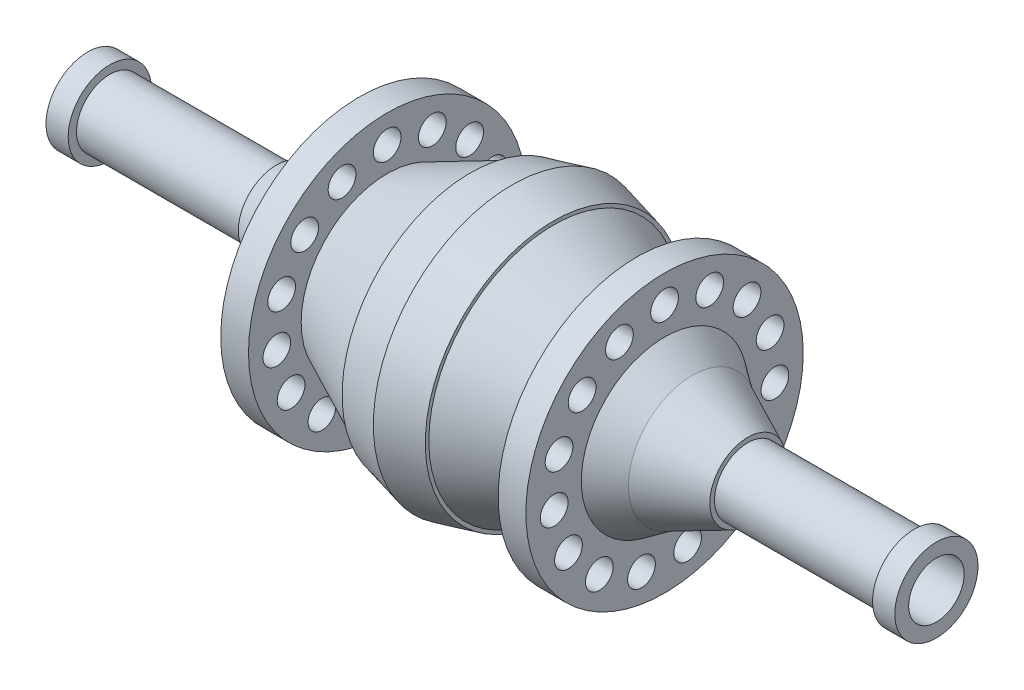
from build123d import *

# Parameters (mm, degrees)
SKETCH1_R                     = 25
BOSS_EXTRUDE1_DEPTH           = 7.5
BOSS_EXTRUDE1_TAPER           = 14
BOSS_EXTRUDE1_OTHER_WAY_DEPTH = 7.5
BOSS_EXTRUDE1_OTHER_WAY_TAPER = 14
SKETCH2_R                     = 22.5
BOSS_EXTRUDE2_DEPTH           = 15
BOSS_EXTRUDE2_TAPER           = 25
SKETCH3_R                     = 22.5
BOSS_EXTRUDE3_DEPTH           = 15
BOSS_EXTRUDE3_TAPER           = 25
SKETCH4_R                     = 25
BOSS_EXTRUDE4_DEPTH           = 5
BOSS_EXTRUDE5_START           = 5
SKETCH5_R                     = 25
BOSS_EXTRUDE5_DEPTH           = 5
SKETCH6_R                     = 2.5
CUT_EXTRUDE1_DEPTH            = 5
CUT_EXTRUDE2_START            = -50
SKETCH6_2_R                   = 2.5
CUT_EXTRUDE2_DEPTH            = 5
SKETCH7_R                     = 15
BOSS_EXTRUDE6_DEPTH           = 5
BOSS_EXTRUDE6_TAPER           = 35
SKETCH8_R                     = 11.498962309
BOSS_EXTRUDE7_DEPTH           = 10
BOSS_EXTRUDE7_TAPER           = 25
SKETCH10_R                    = 6
BOSS_EXTRUDE8_DEPTH           = 30
SKETCH11_R                    = 7.5
BOSS_EXTRUDE10_DEPTH          = 4
SKETCH14_R                    = 15
BOSS_EXTRUDE11_DEPTH          = 5
BOSS_EXTRUDE11_TAPER          = 35
SKETCH16_R                    = 11.509262746
BOSS_EXTRUDE12_DEPTH          = 10
BOSS_EXTRUDE12_TAPER          = 25
BOSS_EXTRUDE13_START          = 30
SKETCH17_R                    = 6
BOSS_EXTRUDE13_DEPTH          = 30
BOSS_EXTRUDE14_START          = 4
SKETCH18_R                    = 7.5
BOSS_EXTRUDE14_DEPTH          = 4
CUT_EXTRUDE3_START            = -153
SKETCH20_R                    = 5
CUT_EXTRUDE3_DEPTH            = 153


with BuildPart() as part:
    # Sketch1 → Boss-Extrude1 (new body)
    with BuildSketch(Plane(origin=(0, 0, 0), x_dir=(0, 0, -1), z_dir=(1, 0, 0))):
        Circle(SKETCH1_R)
    extrude(amount=BOSS_EXTRUDE1_DEPTH, taper=BOSS_EXTRUDE1_TAPER)

    # Sketch1 → Boss-Extrude1 other way (add)
    with BuildSketch(Plane(origin=(0, 0, 0), x_dir=(0, 0, -1), z_dir=(1, 0, 0))):
        Circle(SKETCH1_R)
    extrude(amount=-BOSS_EXTRUDE1_OTHER_WAY_DEPTH, taper=BOSS_EXTRUDE1_OTHER_WAY_TAPER)

    # Sketch2 → Boss-Extrude2 (add)
    with BuildSketch(Plane.ZY.offset(7.5)):
        Circle(SKETCH2_R)
    extrude(amount=BOSS_EXTRUDE2_DEPTH, taper=BOSS_EXTRUDE2_TAPER)

    # Sketch3 → Boss-Extrude3 (add)
    with BuildSketch(Plane(origin=(7.5, 0, 0), x_dir=(0, 0, -1), z_dir=(1, 0, 0))):
        Circle(SKETCH3_R)
    extrude(amount=BOSS_EXTRUDE3_DEPTH, taper=BOSS_EXTRUDE3_TAPER)

    # Sketch4 → Boss-Extrude4 (add)
    with BuildSketch(Plane(origin=(22.5, 0, 0), x_dir=(0, 0, -1), z_dir=(1, 0, 0))):
        Circle(SKETCH4_R)
    extrude(amount=BOSS_EXTRUDE4_DEPTH)

    # Sketch5 → Boss-Extrude5 (add)
    with BuildSketch(Plane.ZY.offset(22.5).offset(BOSS_EXTRUDE5_START)):
        with Locations(Location((0, 0, 0), (0, 0, 180))):
            Circle(SKETCH5_R)
    extrude(amount=-BOSS_EXTRUDE5_DEPTH)

    # Sketch6 → Cut-Extrude1 (cut)
    with BuildSketch(Plane.ZY.offset(27.5)):
        with Locations((0, 20)):
            Circle(SKETCH6_R)
        with Locations((8.134732862, 18.270909153)):
            Circle(SKETCH6_R)
        with Locations((14.86289651, 13.382612127)):
            Circle(SKETCH6_R)
        with Locations((19.021130326, 6.180339888)):
            Circle(SKETCH6_R)
        with Locations((19.890437907, -2.090569265)):
            Circle(SKETCH6_R)
        with Locations((17.320508076, -10)):
            Circle(SKETCH6_R)
        with Locations((11.755705046, -16.180339887)):
            Circle(SKETCH6_R)
        with Locations((4.158233816, -19.562952015)):
            Circle(SKETCH6_R)
        with Locations((-4.158233816, -19.562952015)):
            Circle(SKETCH6_R)
        with Locations((-11.755705046, -16.180339888)):
            Circle(SKETCH6_R)
        with Locations((-17.320508076, -10)):
            Circle(SKETCH6_R)
        with Locations((-19.890437907, -2.090569265)):
            Circle(SKETCH6_R)
        with Locations((-19.021130326, 6.180339887)):
            Circle(SKETCH6_R)
        with Locations((-14.86289651, 13.382612127)):
            Circle(SKETCH6_R)
        with Locations((-8.134732862, 18.270909153)):
            Circle(SKETCH6_R)
    extrude(amount=-CUT_EXTRUDE1_DEPTH, mode=Mode.SUBTRACT)

    # Sketch6<2> → Cut-Extrude2 (cut)
    with BuildSketch(Plane.ZY.offset(27.5).offset(CUT_EXTRUDE2_START)):
        with Locations((0, 20)):
            Circle(SKETCH6_2_R)
        with Locations((8.134732862, 18.270909153)):
            Circle(SKETCH6_2_R)
        with Locations((14.86289651, 13.382612127)):
            Circle(SKETCH6_2_R)
        with Locations((19.021130326, 6.180339888)):
            Circle(SKETCH6_2_R)
        with Locations((19.890437907, -2.090569265)):
            Circle(SKETCH6_2_R)
        with Locations((17.320508076, -10)):
            Circle(SKETCH6_2_R)
        with Locations((11.755705046, -16.180339887)):
            Circle(SKETCH6_2_R)
        with Locations((4.158233816, -19.562952015)):
            Circle(SKETCH6_2_R)
        with Locations((-4.158233816, -19.562952015)):
            Circle(SKETCH6_2_R)
        with Locations((-11.755705046, -16.180339888)):
            Circle(SKETCH6_2_R)
        with Locations((-17.320508076, -10)):
            Circle(SKETCH6_2_R)
        with Locations((-19.890437907, -2.090569265)):
            Circle(SKETCH6_2_R)
        with Locations((-19.021130326, 6.180339887)):
            Circle(SKETCH6_2_R)
        with Locations((-14.86289651, 13.382612127)):
            Circle(SKETCH6_2_R)
        with Locations((-8.134732862, 18.270909153)):
            Circle(SKETCH6_2_R)
    extrude(amount=-CUT_EXTRUDE2_DEPTH, mode=Mode.SUBTRACT)

    # Sketch7 → Boss-Extrude6 (add)
    with BuildSketch(Plane.ZY.offset(27.5)):
        Circle(SKETCH7_R)
    extrude(amount=BOSS_EXTRUDE6_DEPTH, taper=BOSS_EXTRUDE6_TAPER)

    # Sketch8 → Boss-Extrude7 (add)
    with BuildSketch(Plane.ZY.offset(32.5)):
        Circle(SKETCH8_R)
    extrude(amount=BOSS_EXTRUDE7_DEPTH, taper=BOSS_EXTRUDE7_TAPER)

    # Sketch10 → Boss-Extrude8 (add)
    with BuildSketch(Plane.ZY.offset(42.5)):
        Circle(SKETCH10_R)
    extrude(amount=BOSS_EXTRUDE8_DEPTH)

    # Sketch11 → Boss-Extrude10 (add)
    with BuildSketch(Plane.ZY.offset(72.5)):
        Circle(SKETCH11_R)
    extrude(amount=BOSS_EXTRUDE10_DEPTH)

    # Sketch14 → Boss-Extrude11 (add)
    with BuildSketch(Plane(origin=(27.5, 0, 0), x_dir=(0, 0, -1), z_dir=(1, 0, 0))):
        Circle(SKETCH14_R)
    extrude(amount=BOSS_EXTRUDE11_DEPTH, taper=BOSS_EXTRUDE11_TAPER)

    # Sketch16 → Boss-Extrude12 (add)
    with BuildSketch(Plane(origin=(32.5, 0, 0), x_dir=(0, 0, -1), z_dir=(1, 0, 0))):
        Circle(SKETCH16_R)
    extrude(amount=BOSS_EXTRUDE12_DEPTH, taper=BOSS_EXTRUDE12_TAPER)

    # Sketch17 → Boss-Extrude13 (add)
    with BuildSketch(Plane(origin=(42.5, 0, 0), x_dir=(0, 0, -1), z_dir=(1, 0, 0)).offset(BOSS_EXTRUDE13_START)):
        with Locations(Location((0, 0, 0), (0, 0, 180))):
            Circle(SKETCH17_R)
    extrude(amount=-BOSS_EXTRUDE13_DEPTH)

    # Sketch18 → Boss-Extrude14 (add)
    with BuildSketch(Plane(origin=(72.5, 0, 0), x_dir=(0, 0, -1), z_dir=(1, 0, 0)).offset(BOSS_EXTRUDE14_START)):
        with Locations(Location((0, 0, 0), (0, 0, 180))):
            Circle(SKETCH18_R)
    extrude(amount=-BOSS_EXTRUDE14_DEPTH)

    # Sketch20 → Cut-Extrude3 (cut)
    with BuildSketch(Plane.ZY.offset(76.5).offset(CUT_EXTRUDE3_START)):
        Circle(SKETCH20_R)
    cut_extrude3 = extrude(amount=CUT_EXTRUDE3_DEPTH, mode=Mode.SUBTRACT)

    # Mirror1: Cut-Extrude3 across plane
    add(cut_extrude3.mirror(Plane(origin=(0, 0, 0), x_dir=(0, 0, 1), z_dir=(1, 0, 0))), mode=Mode.SUBTRACT)


solid = part.part
